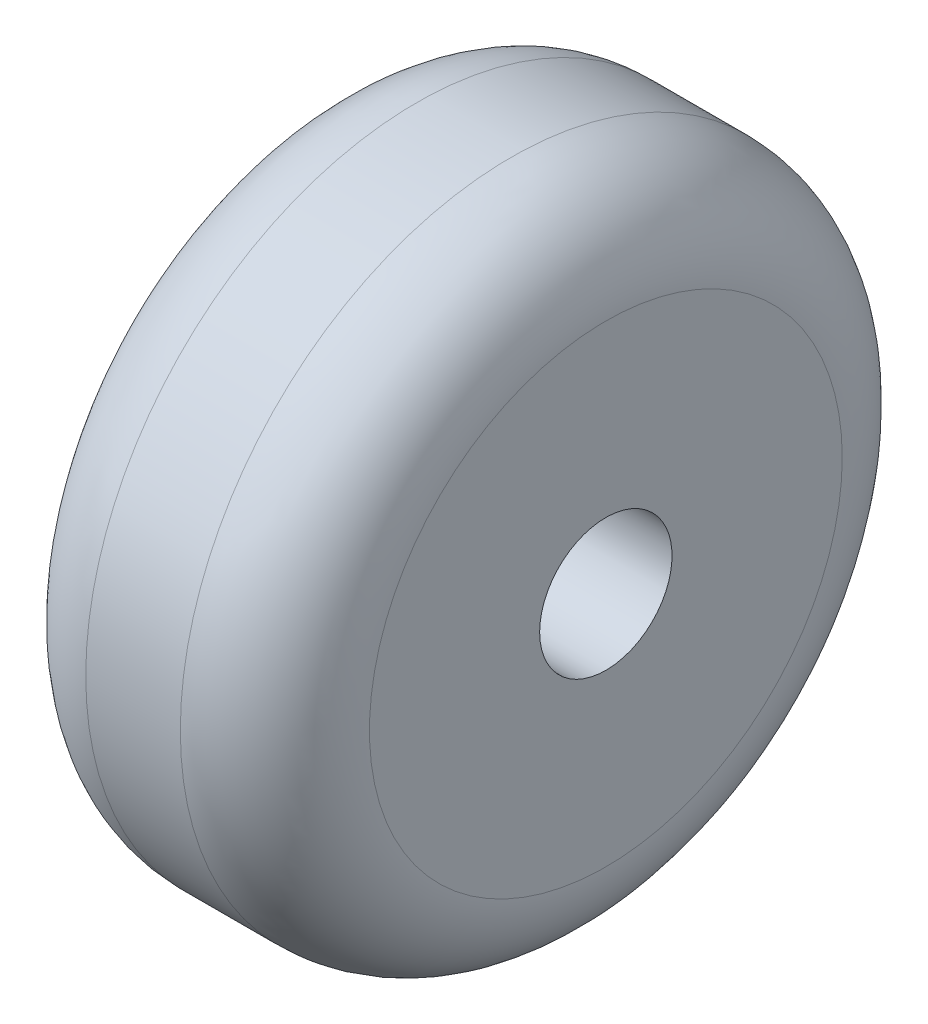
from build123d import *

# Parameters (mm, degrees)
SKETCH1_R               = 88.9
BOSS_EXTRUDE1_DEPTH     = 76.2
FILLET1_R               = 25.4
FILLET2_R               = 25.4
CUT_EXTRUDE1_DEPTH      = 148.013128726
CUT_EXTRUDE1_DEPTH_BACK = 148.013128726
SKETCH2_R               = 17.78


with BuildPart() as part:
    # Sketch1 → Boss-Extrude1 (new body)
    with BuildSketch(Plane(origin=(0, 0, 0), x_dir=(0, 0, -1), z_dir=(1, 0, 0))):
        with Locations(Location((0, 0, 0), (0, 0, 180))):
            Circle(SKETCH1_R)
    extrude(amount=BOSS_EXTRUDE1_DEPTH)

    # Fillet1
    fillet1_edges = [part.edges().sort_by_distance(p)[0] for p in [
        (76.2, 0, -88.9),
    ]]
    fillet(fillet1_edges, radius=FILLET1_R)

    # Fillet2
    fillet2_edges = [part.edges().sort_by_distance(p)[0] for p in [
        (0, 0, -88.9),
    ]]
    fillet(fillet2_edges, radius=FILLET2_R)

    # Sketch2 → Cut-Extrude1 (cut, two sides: drawn at the far end of the back side and taken through both)
    with BuildSketch(Plane.ZY.offset(-CUT_EXTRUDE1_DEPTH_BACK)):
        Circle(SKETCH2_R)
    extrude(amount=CUT_EXTRUDE1_DEPTH + CUT_EXTRUDE1_DEPTH_BACK, mode=Mode.SUBTRACT)


solid = part.part
